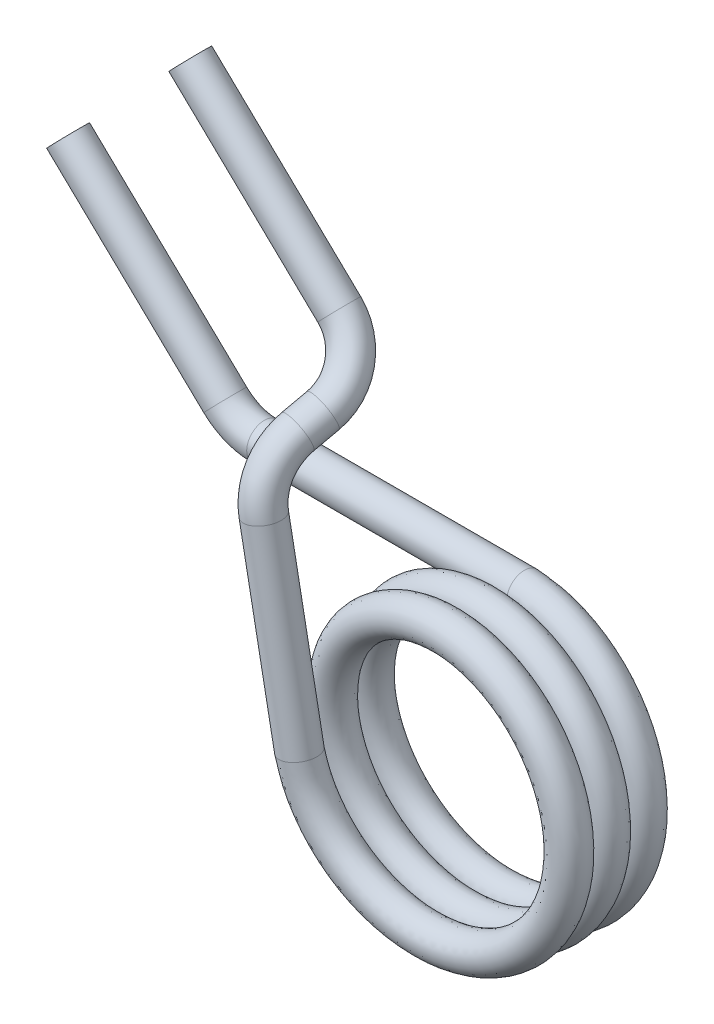
from build123d import *

# Parameters (mm, degrees)
ESQUISSE2_R = 1.25
ESQUISSE3_R = 1.25
ESQUISSE4_R = 1.25


with BuildPart() as part:
    # Base-Balayage: sweep along a curve in space
    with BuildLine() as base_balayage_path:
        add(Edge.make_bspline(
            [(0, 9, 0), (1.184528206, 9, 0.05446235), (3.580075878, 8.519834725, 0.164631894), (6.594534731, 6.471375062, 0.328885545), (8.586486918, 3.414051181, 0.493407323), (9.238347333, -0.175511065, 0.657857257), (8.450381477, -3.737711764, 0.822326441), (6.344924465, -6.717216572, 0.986790467), (3.250345078, -8.649531349, 1.151255876), (-0.350959153, -9.233415135, 1.315720914), (-3.897548052, -8.377842538, 1.480186051), (-6.836523705, -6.216194263, 1.644651162), (-8.709709625, -3.085463544, 1.809116279), (-9.225083015, 0.526279903, 1.973581395), (-8.302298959, 4.055978196, 2.138046512), (-6.085216202, 6.953364, 2.302511628), (-2.919470011, 8.766745234, 2.466976744), (0.70141111, 9.213422252, 2.63144186), (4.212944748, 8.223759705, 2.795906977), (7.067695374, 5.952042444, 2.960372093), (8.820617577, 2.75242306, 3.124837209), (9.198437059, -0.87628923, 3.289302326), (8.142253114, -4.368391165, 3.453767442), (5.81672104, -7.179476547, 3.618232558), (2.584382967, -8.871307222, 3.782697674), (-1.050851164, -9.180132841, 3.947162791), (-4.522261358, -8.057808595, 4.111627907), (-7.288667186, -5.679300819, 4.276093023), (-8.918795878, -2.415410364, 4.44055814), (-9.158516202, 1.225033924, 4.605023256), (-7.970456618, 4.674499806, 4.769488372), (-5.539831364, 7.395227893, 4.933953488), (-2.245566222, 8.963066413, 5.098418605), (1.398774662, 9.133594937, 5.262883721), (4.825051574, 7.880228728, 5.427348838), (7.499120236, 5.398362909, 5.591813949), (9.004102781, 2.074912168, 5.756279086), (9.105378302, -1.572011976, 5.920744124), (7.787156486, -4.973857537, 6.085209533), (5.254950203, -7.600324645, 6.249673559), (1.90349595, -9.041823309, 6.414142743), (-1.744631742, -9.074126027, 6.578592677), (-5.121056632, -7.690342157, 6.743114455), (-7.698085705, -5.113120723, 6.907368106), (-8.618626804, -2.849978786, 7.01753765), (-8.840585257, -1.686431831, 7.072)],
            knots=[0, 0, 0, 0, 0.023255814, 0.046511628, 0.069767442, 0.093023256, 0.11627907, 0.139534884, 0.162790698, 0.186046512, 0.209302326, 0.23255814, 0.255813953, 0.279069767, 0.302325581, 0.325581395, 0.348837209, 0.372093023, 0.395348837, 0.418604651, 0.441860465, 0.465116279, 0.488372093, 0.511627907, 0.534883721, 0.558139535, 0.581395349, 0.604651163, 0.627906977, 0.651162791, 0.674418605, 0.697674419, 0.720930233, 0.744186047, 0.76744186, 0.790697674, 0.813953488, 0.837209302, 0.860465116, 0.88372093, 0.906976744, 0.930232558, 0.953488372, 0.976744186, 1, 1, 1, 1], degree=3))
    # Esquisse2 → Base-Balayage (sweep)
    with BuildSketch(Plane(origin=(0, 0, 0), x_dir=(0, 0, -1), z_dir=(1, 0, 0))):
        with Locations((0, 9)):
            Circle(ESQUISSE2_R)
    sweep(path=base_balayage_path.line, is_frenet=True)

    # Boss.-Balayage1: sweep along a path in Esquisse5
    with BuildLine(Plane.XY) as boss_balayage1_path:
        Line((0, 9), (-18.39364468, 9))
        ThreePointArc((-18.39364468, 9), (-19.884290071, 9.288130347), (-21.160185375, 10.111011841))
        Line((-21.160185375, 10.111011841), (-32.278199675, 20.757797954))
    # Esquisse3 → Boss.-Balayage1 (sweep)
    with BuildSketch(Plane.ZY):
        with Locations((0, 9)):
            Circle(ESQUISSE3_R)
    sweep(path=boss_balayage1_path.line)

    # Boss.-Balayage2: sweep along a curve in space
    with BuildLine() as boss_balayage2_path:
        Line((-8.840585257, -1.686431831, 7.072), (-11.363227369, 11.537352916, 7.072000004))
        ThreePointArc((-11.440645853, 15.321931254, 4.590892271), (-11.61685752, 13.79279189, 6.392085934), (-11.363227369, 11.537352916, 7.072000004))
        Line((-11.440645853, 15.321931254, 4.590892271), (-11.174459322, 15.98531973, 3.079096579))
        ThreePointArc((-13.092231858, 19.692109702, 0), (-11.484503101, 17.621604893, 0.874056719), (-11.174459322, 15.98531973, 3.079096579))
        Line((-13.092231858, 19.692109702, 0), (-23.632760003, 29.785885951, 0))
    # Esquisse4 → Boss.-Balayage2 (sweep)
    with BuildSketch(Plane(origin=(-8.646e-06, 4.5324e-05, 0), x_dir=(-0.9822862900854757, -0.18738635038367266, -5.452275065308374e-11), z_dir=(-0.18738635038367266, 0.9822862900854757, 2.85810307712464e-10))):
        with Locations((8.999999999, 7.072)):
            Circle(ESQUISSE4_R)
    sweep(path=boss_balayage2_path.line)


solid = part.part
